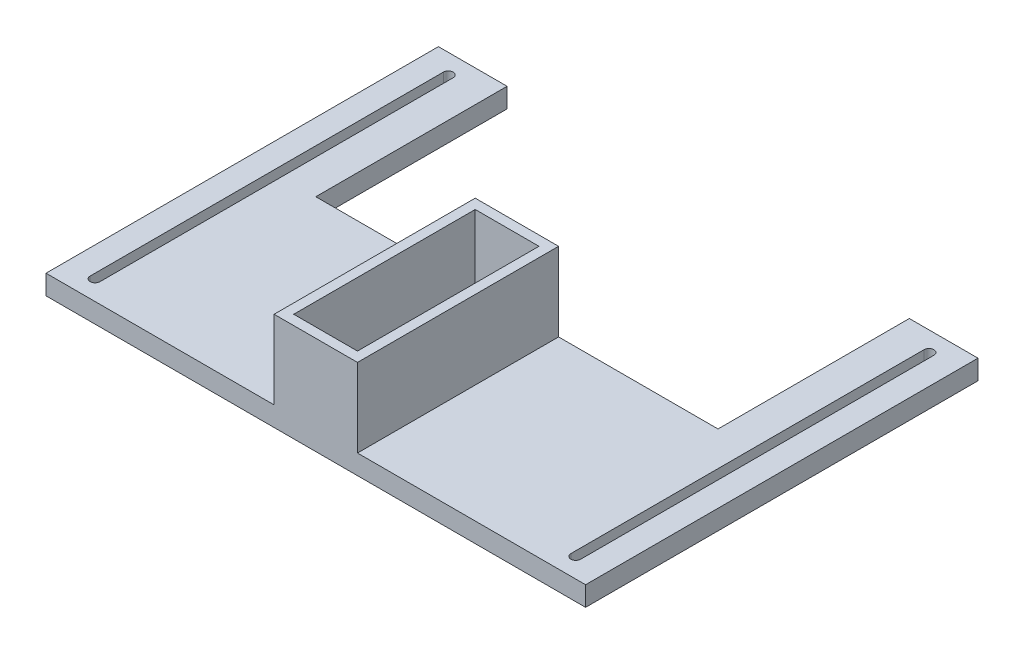
from build123d import *

# Parameters (mm, degrees)
SKETCH1_W           = 8.5
SKETCH1_H           = 20.5
SKETCH1_W_2         = 6.5
SKETCH1_H_2         = 18.5
EXTRUDE_THIN1_DEPTH = 8
BOSS_EXTRUDE1_DEPTH = 2
CUT_EXTRUDE1_REACH  = 43.729


with BuildPart() as part:
    # Sketch1 → Extrude-Thin1 (new body)
    with BuildSketch(Plane(origin=(0, 0, 0), x_dir=(1, 0, 0), z_dir=(0, 1, 0))):
        Rectangle(SKETCH1_W, SKETCH1_H)
        Rectangle(SKETCH1_W_2, SKETCH1_H_2, mode=Mode.SUBTRACT)
    extrude(amount=EXTRUDE_THIN1_DEPTH)

    # Sketch2 → Boss-Extrude1 (add)
    with BuildSketch(Plane.XZ):
        Polygon((20.5, -29.75), (20.5, -10.25), (-20.5, -10.25), (-20.5, -29.75), (-27.5, -29.75), (-27.5, 10.25), (27.5, 10.25), (27.5, -29.75), align=None)
    extrude(amount=BOSS_EXTRUDE1_DEPTH)

    # Sketch3 → Cut-Extrude1 (cut, up to next)
    with BuildSketch(Plane.XZ.offset(2), mode=Mode.PRIVATE) as cut_extrude1_sk1:
        with BuildLine():
            Line((-24, 8.25), (-24, -27.75))
            ThreePointArc((-24, -27.75), (-24.5, -28.25), (-25, -27.75))
            Line((-25, -27.75), (-25, 8.25))
            ThreePointArc((-25, 8.25), (-24.5, 8.75), (-24, 8.25))
        make_face()
    cut_extrude1_tool1 = extrude(cut_extrude1_sk1.sketch, amount=-CUT_EXTRUDE1_REACH, mode=Mode.PRIVATE) & part.part
    cut_extrude1 = cut_extrude1_tool1.solids().sort_by_distance((-24.5, -2, -9.75))[0]
    add(cut_extrude1, mode=Mode.SUBTRACT)

    # Mirror1: Cut-Extrude1 across plane
    add(cut_extrude1.mirror(Plane(origin=(0, 0, 0), x_dir=(0, 0, 1), z_dir=(1, 0, 0))), mode=Mode.SUBTRACT)


solid = part.part
